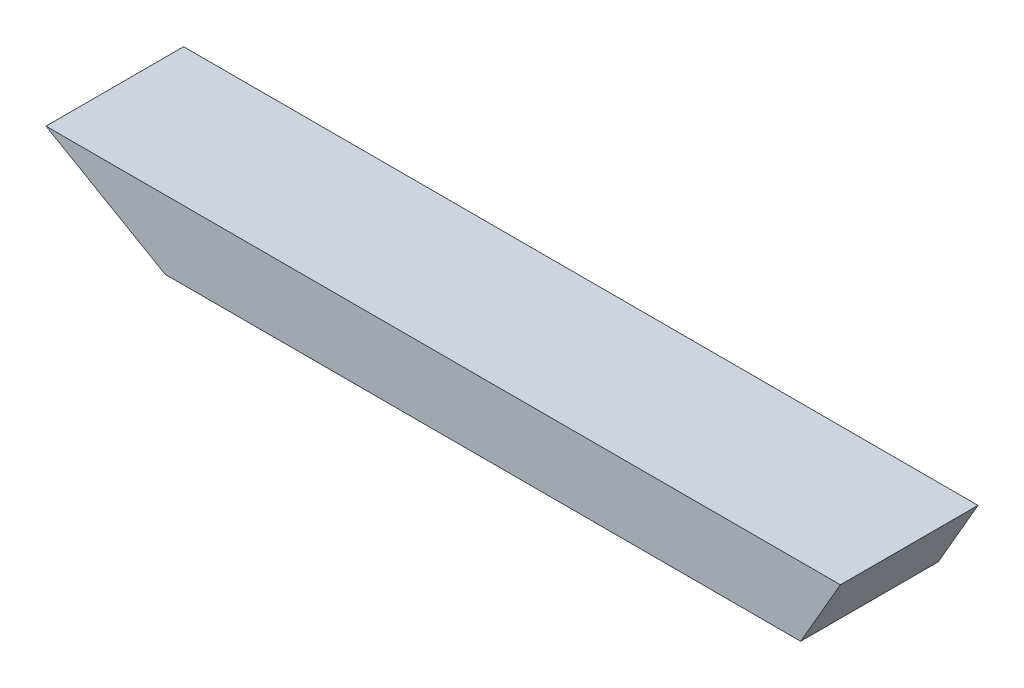
from build123d import *

# Parameters (mm, degrees)
SKETCH1_W           = 293.3
SKETCH1_H           = 50.8
BOSS_EXTRUDE1_DEPTH = 25.4
CUT_EXTRUDE1_DEPTH  = 50.8


with BuildPart() as part:
    # Sketch1 → Boss-Extrude1 (new body)
    with BuildSketch(Plane(origin=(0, 0, 0), x_dir=(1, 0, 0), z_dir=(0, 1, 0))):
        Rectangle(SKETCH1_W, SKETCH1_H)
    extrude(amount=BOSS_EXTRUDE1_DEPTH)

    # Sketch2 → Cut-Extrude1 (cut)
    with BuildSketch(Plane.XY.offset(25.4)):
        Polygon((-146.65, 25.4), (-102.655909488, 0), (-146.65, 0), align=None)
        Polygon((146.65, 25.4), (131.985303163, 0), (146.65, 0), align=None)
    extrude(amount=-CUT_EXTRUDE1_DEPTH, mode=Mode.SUBTRACT)


solid = part.part
